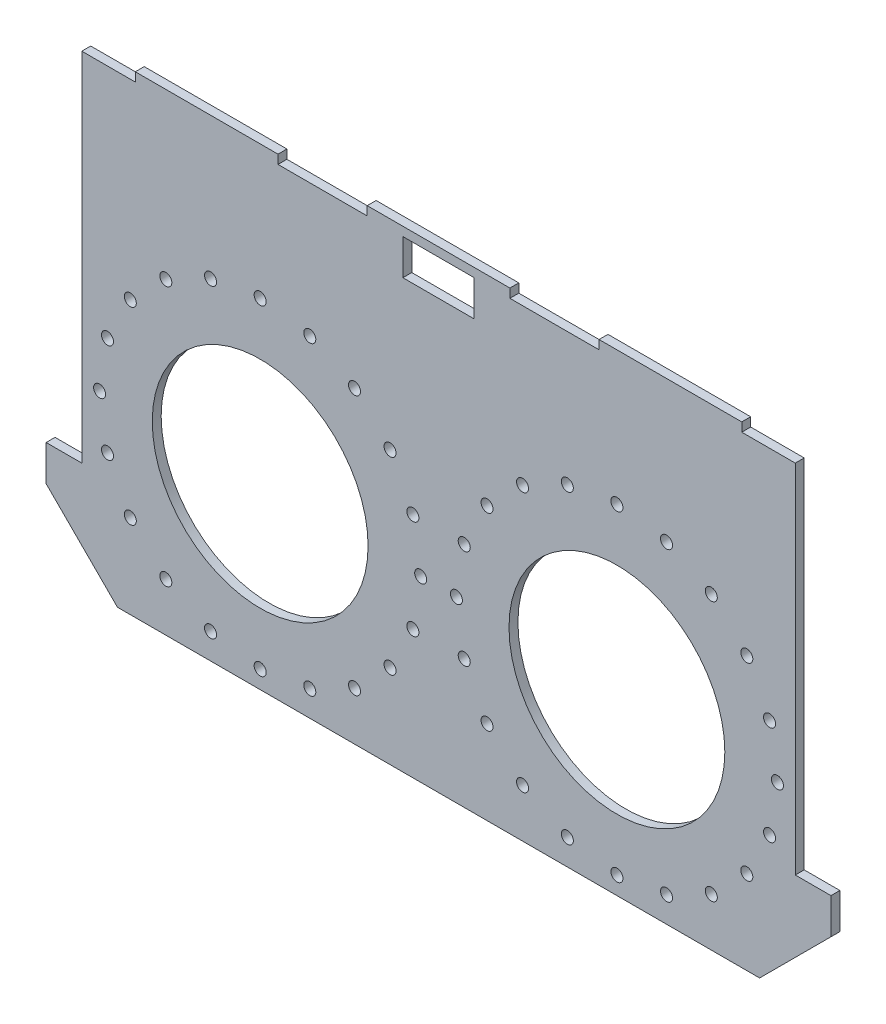
from build123d import *

# Parameters (mm, degrees)
ESQUISSE1_W             = 880
ESQUISSE1_H             = 530
ESQUISSE1_R             = 121
ESQUISSE1_R_2           = 6.75
BOSS_EXTRU_1_DEPTH      = 10
CHANFREIN1_SIZE         = 80
ESQUISSE2_W             = 100
ESQUISSE2_H             = 10
ESQUISSE2_W_2           = 80
ESQUISSE2_H_2           = 40
ENL_V_MAT_EXTRU_1_DEPTH = 10


with BuildPart() as part:
    # Esquisse1 → Boss.-Extru.1 (new body)
    with BuildSketch(Plane.XY):
        with Locations((440, 265)):
            Rectangle(ESQUISSE1_W, ESQUISSE1_H)
        with Locations((640, 200)):
            Circle(ESQUISSE1_R, mode=Mode.SUBTRACT)
        with Locations((820, 200)):
            Circle(ESQUISSE1_R_2, mode=Mode.SUBTRACT)
        with Locations((811.190172933, 144.376941013)):
            Circle(ESQUISSE1_R_2, mode=Mode.SUBTRACT)
        with Locations((785.623058987, 94.198654587)):
            Circle(ESQUISSE1_R_2, mode=Mode.SUBTRACT)
        with Locations((745.801345413, 54.376941013)):
            Circle(ESQUISSE1_R_2, mode=Mode.SUBTRACT)
        with Locations((695.623058987, 28.809827067)):
            Circle(ESQUISSE1_R_2, mode=Mode.SUBTRACT)
        with Locations((640, 20)):
            Circle(ESQUISSE1_R_2, mode=Mode.SUBTRACT)
        with Locations((584.376941012, 28.809827067)):
            Circle(ESQUISSE1_R_2, mode=Mode.SUBTRACT)
        with Locations((534.198654587, 54.376941013)):
            Circle(ESQUISSE1_R_2, mode=Mode.SUBTRACT)
        with Locations((494.376941012, 94.198654587)):
            Circle(ESQUISSE1_R_2, mode=Mode.SUBTRACT)
        with Locations((468.809827067, 144.376941013)):
            Circle(ESQUISSE1_R_2, mode=Mode.SUBTRACT)
        with Locations((460, 200)):
            Circle(ESQUISSE1_R_2, mode=Mode.SUBTRACT)
        with Locations((468.809827067, 255.623058987)):
            Circle(ESQUISSE1_R_2, mode=Mode.SUBTRACT)
        with Locations((494.376941012, 305.801345413)):
            Circle(ESQUISSE1_R_2, mode=Mode.SUBTRACT)
        with Locations((534.198654587, 345.623058987)):
            Circle(ESQUISSE1_R_2, mode=Mode.SUBTRACT)
        with Locations((584.376941012, 371.190172933)):
            Circle(ESQUISSE1_R_2, mode=Mode.SUBTRACT)
        with Locations((640, 380)):
            Circle(ESQUISSE1_R_2, mode=Mode.SUBTRACT)
        with Locations((695.623058987, 371.190172933)):
            Circle(ESQUISSE1_R_2, mode=Mode.SUBTRACT)
        with Locations((745.801345413, 345.623058987)):
            Circle(ESQUISSE1_R_2, mode=Mode.SUBTRACT)
        with Locations((785.623058987, 305.801345413)):
            Circle(ESQUISSE1_R_2, mode=Mode.SUBTRACT)
        with Locations((811.190172933, 255.623058987)):
            Circle(ESQUISSE1_R_2, mode=Mode.SUBTRACT)
        with Locations(Location((68.809827067, 255.623058987, 0), (0, 0, 180))):
            Circle(ESQUISSE1_R_2, mode=Mode.SUBTRACT)
        with Locations(Location((94.376941013, 305.801345413, 0), (0, 0, 180))):
            Circle(ESQUISSE1_R_2, mode=Mode.SUBTRACT)
        with Locations(Location((134.198654587, 345.623058987, 0), (0, 0, 180))):
            Circle(ESQUISSE1_R_2, mode=Mode.SUBTRACT)
        with Locations(Location((184.376941013, 371.190172933, 0), (0, 0, 180))):
            Circle(ESQUISSE1_R_2, mode=Mode.SUBTRACT)
        with Locations(Location((240, 380, 0), (0, 0, 180))):
            Circle(ESQUISSE1_R_2, mode=Mode.SUBTRACT)
        with Locations(Location((295.623058987, 371.190172933, 0), (0, 0, 180))):
            Circle(ESQUISSE1_R_2, mode=Mode.SUBTRACT)
        with Locations(Location((345.801345413, 345.623058987, 0), (0, 0, 180))):
            Circle(ESQUISSE1_R_2, mode=Mode.SUBTRACT)
        with Locations(Location((385.623058987, 305.801345413, 0), (0, 0, 180))):
            Circle(ESQUISSE1_R_2, mode=Mode.SUBTRACT)
        with Locations(Location((411.190172933, 255.623058987, 0), (0, 0, 180))):
            Circle(ESQUISSE1_R_2, mode=Mode.SUBTRACT)
        with Locations(Location((420, 200, 0), (0, 0, 180))):
            Circle(ESQUISSE1_R_2, mode=Mode.SUBTRACT)
        with Locations(Location((411.190172933, 144.376941013, 0), (0, 0, 180))):
            Circle(ESQUISSE1_R_2, mode=Mode.SUBTRACT)
        with Locations(Location((385.623058987, 94.198654587, 0), (0, 0, 180))):
            Circle(ESQUISSE1_R_2, mode=Mode.SUBTRACT)
        with Locations(Location((345.801345413, 54.376941013, 0), (0, 0, 180))):
            Circle(ESQUISSE1_R_2, mode=Mode.SUBTRACT)
        with Locations(Location((295.623058987, 28.809827067, 0), (0, 0, 180))):
            Circle(ESQUISSE1_R_2, mode=Mode.SUBTRACT)
        with Locations(Location((240, 20, 0), (0, 0, 180))):
            Circle(ESQUISSE1_R_2, mode=Mode.SUBTRACT)
        with Locations(Location((184.376941013, 28.809827067, 0), (0, 0, 180))):
            Circle(ESQUISSE1_R_2, mode=Mode.SUBTRACT)
        with Locations(Location((134.198654587, 54.376941013, 0), (0, 0, 180))):
            Circle(ESQUISSE1_R_2, mode=Mode.SUBTRACT)
        with Locations(Location((94.376941013, 94.198654587, 0), (0, 0, 180))):
            Circle(ESQUISSE1_R_2, mode=Mode.SUBTRACT)
        with Locations(Location((68.809827067, 144.376941013, 0), (0, 0, 180))):
            Circle(ESQUISSE1_R_2, mode=Mode.SUBTRACT)
        with Locations(Location((60, 200, 0), (0, 0, 180))):
            Circle(ESQUISSE1_R_2, mode=Mode.SUBTRACT)
        with Locations(Location((240, 200, 0), (0, 0, 180))):
            Circle(ESQUISSE1_R, mode=Mode.SUBTRACT)
    extrude(amount=BOSS_EXTRU_1_DEPTH)

    # Chanfrein1
    chanfrein1_edges = [part.edges().sort_by_distance(p)[0] for p in [
        (880, 0, 5),
        (0, 0, 5),
    ]]
    chamfer(chanfrein1_edges, length=CHANFREIN1_SIZE)

    # Esquisse2 → Enlèv. mat.-Extru.1 (cut)
    with BuildSketch(Plane(origin=(0, 0, 0), x_dir=(-1, 0, 0), z_dir=(0, 0, -1))):
        Polygon((-880, 530), (-840, 530), (-780, 530), (-780, 520), (-840, 520), (-840, 120), (-880, 120), align=None)
        with Locations((-570, 525)):
            Rectangle(ESQUISSE2_W, ESQUISSE2_H)
        with Locations((-310, 525)):
            Rectangle(ESQUISSE2_W, ESQUISSE2_H)
        Polygon((-100, 530), (-100, 520), (-40, 520), (-40, 120), (0, 120), (0, 530), (-40, 530), align=None)
        with Locations((-440, 500)):
            Rectangle(ESQUISSE2_W_2, ESQUISSE2_H_2)
    extrude(amount=-ENL_V_MAT_EXTRU_1_DEPTH, mode=Mode.SUBTRACT)


solid = part.part
